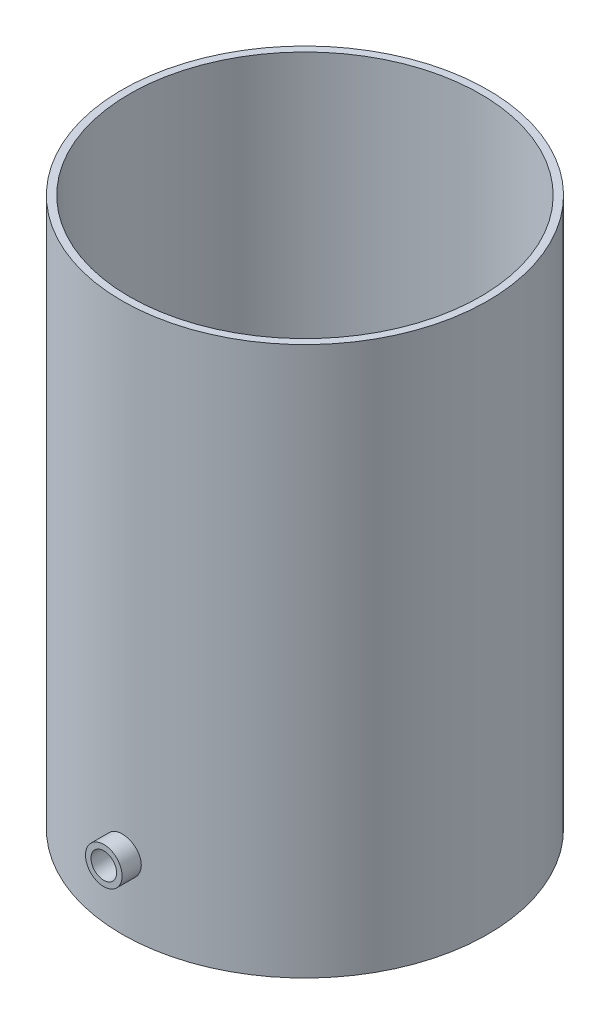
from build123d import *

# Parameters (mm, degrees)
SKETCH1_R                = 50
SKETCH1_R_2              = 48
BOSS_EXTRUDE2_DEPTH      = 150
BOSS_EXTRUDE3_REACH      = 191.803
BOSS_EXTRUDE3_END_RADIUS = 50
SKETCH2_R                = 5
SKETCH3_R                = 3.5
CUT_EXTRUDE1_DEPTH       = 12
BOSS_EXTRUDE4_REACH      = 194.614
BOSS_EXTRUDE4_END_RADIUS = 50
SKETCH4_R                = 5
CUT_EXTRUDE2_START       = -12
SKETCH5_R                = 3.5
CUT_EXTRUDE2_DEPTH       = 12


with BuildPart() as part:
    # Sketch1 → Boss-Extrude2 (new body)
    with BuildSketch(Plane(origin=(0, 0, 0), x_dir=(1, 0, 0), z_dir=(0, 1, 0))):
        with Locations(Location((0, 0, 0), (0, 0, 270))):
            Circle(SKETCH1_R)
        with Locations(Location((0, 0, 0), (0, 0, 270))):
            Circle(SKETCH1_R_2, mode=Mode.SUBTRACT)
    extrude(amount=BOSS_EXTRUDE2_DEPTH)

    # Boss-Extrude3: up to this cylinder (the profile starts outside it)
    boss_extrude3_end = Plane(origin=(0, 18.790559, 0), z_dir=(0, -1, 0)) * Cylinder(BOSS_EXTRUDE3_END_RADIUS, 484.606, mode=Mode.PRIVATE)
    # Sketch2 → Boss-Extrude3 (add, up to the surface)
    with BuildSketch(Plane.XY.offset(55), mode=Mode.PRIVATE) as boss_extrude3_sk1:
        with Locations((0, 18.790558937)):
            Circle(SKETCH2_R)
    boss_extrude3_tool1 = extrude(boss_extrude3_sk1.sketch, amount=-BOSS_EXTRUDE3_REACH, mode=Mode.PRIVATE) - boss_extrude3_end
    add(boss_extrude3_tool1.solids().sort_by_distance((0, 18.790559, 55))[0])

    # Sketch3 → Cut-Extrude1 (cut)
    with BuildSketch(Plane.XY.offset(55)):
        with Locations((0, 18.790558937)):
            Circle(SKETCH3_R)
    extrude(amount=-CUT_EXTRUDE1_DEPTH, mode=Mode.SUBTRACT)

    # Boss-Extrude4: up to this cylinder (the profile starts outside it)
    boss_extrude4_end = Plane(origin=(0, 18.790559, 0), z_dir=(0, -1, 0)) * Cylinder(BOSS_EXTRUDE4_END_RADIUS, 490.228, mode=Mode.PRIVATE)
    # Sketch4 → Boss-Extrude4 (add, up to the surface)
    with BuildSketch(Plane.XY.offset(-55), mode=Mode.PRIVATE) as boss_extrude4_sk1:
        with Locations((0, 18.790558937)):
            Circle(SKETCH4_R)
    boss_extrude4_tool1 = extrude(boss_extrude4_sk1.sketch, amount=BOSS_EXTRUDE4_REACH, mode=Mode.PRIVATE) - boss_extrude4_end
    add(boss_extrude4_tool1.solids().sort_by_distance((0, 18.790559, -55))[0])

    # Sketch5 → Cut-Extrude2 (cut)
    with BuildSketch(Plane(origin=(0, 0, -55), x_dir=(-1, 0, 0), z_dir=(0, 0, -1)).offset(CUT_EXTRUDE2_START)):
        with Locations(Location((0, 18.790558937, 0), (0, 0, 180))):
            Circle(SKETCH5_R)
    extrude(amount=CUT_EXTRUDE2_DEPTH, mode=Mode.SUBTRACT)


solid = part.part
